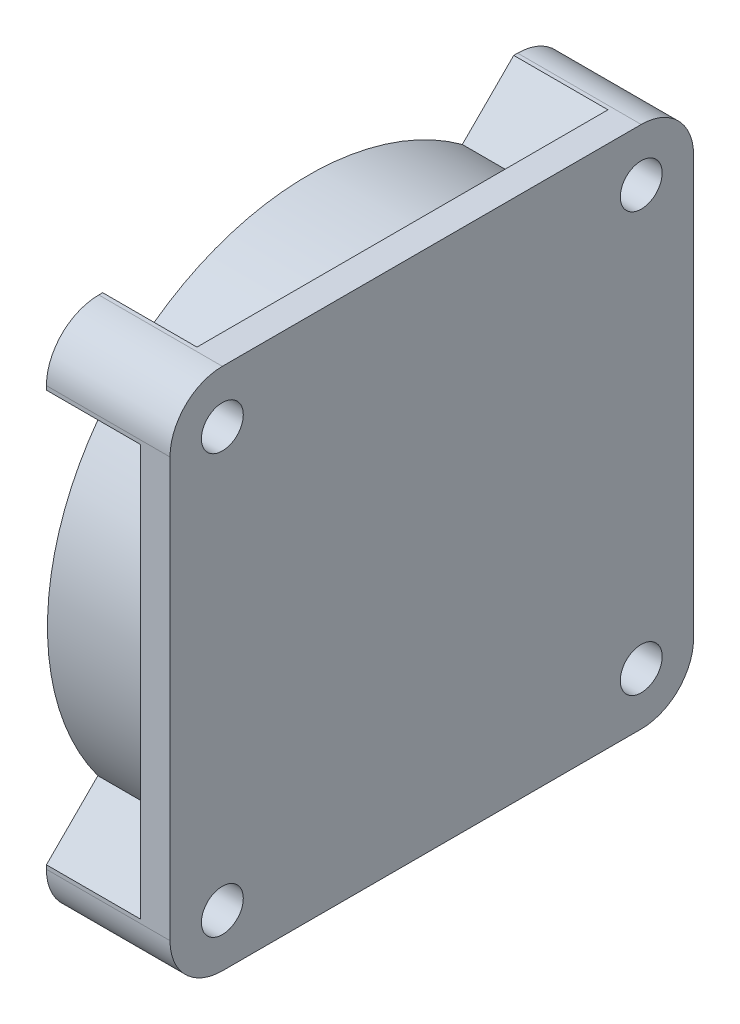
from build123d import *

# Parameters (mm, degrees)
SKETCH1_W          = 50
SKETCH1_H          = 50
SKETCH1_R          = 2
BODY_DEPTH         = 11.8
FILLET1_R          = 5
SKETCH2_R          = 3.05
C_BORES_DEPTH      = 1.5
CUT_EXTRUDE1_DEPTH = 9


with BuildPart() as part:
    # Sketch1 → Body (new body)
    with BuildSketch(Plane(origin=(0, 0, 0), x_dir=(0, 0, -1), z_dir=(1, 0, 0))):
        Rectangle(SKETCH1_W, SKETCH1_H)
        with Locations((-20, -20)):
            Circle(SKETCH1_R, mode=Mode.SUBTRACT)
        with Locations((-20, 20)):
            Circle(SKETCH1_R, mode=Mode.SUBTRACT)
        with Locations((20, 20)):
            Circle(SKETCH1_R, mode=Mode.SUBTRACT)
        with Locations((20, -20)):
            Circle(SKETCH1_R, mode=Mode.SUBTRACT)
    extrude(amount=BODY_DEPTH)

    # Fillet1
    fillet1_edges = [part.edges().sort_by_distance(p)[0] for p in [
        (5.9, -25, -25),
        (5.9, -25, 25),
        (5.9, 25, 25),
        (5.9, 25, -25),
    ]]
    fillet(fillet1_edges, radius=FILLET1_R)

    # Sketch2 → C'Bores (cut)
    with BuildSketch(Plane.ZY):
        with Locations((-20, -20)):
            Circle(SKETCH2_R)
        with Locations((-20, 20)):
            Circle(SKETCH2_R)
        with Locations((20, 20)):
            Circle(SKETCH2_R)
        with Locations((20, -20)):
            Circle(SKETCH2_R)
    extrude(amount=-C_BORES_DEPTH, mode=Mode.SUBTRACT)

    # Sketch3 → Cut-Extrude1 (cut)
    with BuildSketch(Plane.ZY):
        with BuildLine():
            Line((-25, -19.625988463), (-20.087724144, -14.713712607))
            ThreePointArc((-20.087724144, -14.713712607), (-24.9, 0), (-20.087724144, 14.713712607))
            Line((-20.087724144, 14.713712607), (-25, 19.625988463))
            Line((-25, 19.625988463), (-25, -19.625988463))
        make_face()
        with BuildLine():
            Line((-19.625988463, -25), (-14.713712607, -20.087724144))
            ThreePointArc((-14.713712607, -20.087724144), (0, -24.9), (14.713712607, -20.087724144))
            Line((14.713712607, -20.087724144), (19.625988463, -25))
            Line((19.625988463, -25), (-19.625988463, -25))
        make_face()
        with BuildLine():
            Line((-19.625988463, 25), (-14.713712607, 20.087724144))
            ThreePointArc((-14.713712607, 20.087724144), (0, 24.9), (14.713712607, 20.087724144))
            Line((14.713712607, 20.087724144), (19.625988463, 25))
            Line((19.625988463, 25), (-19.625988463, 25))
        make_face()
        with BuildLine():
            Line((25, 19.625988463), (20.087724144, 14.713712607))
            ThreePointArc((20.087724144, 14.713712607), (24.9, 0), (20.087724144, -14.713712607))
            Line((20.087724144, -14.713712607), (25, -19.625988463))
            Line((25, -19.625988463), (25, 19.625988463))
        make_face()
    extrude(amount=-CUT_EXTRUDE1_DEPTH, mode=Mode.SUBTRACT)


solid = part.part
